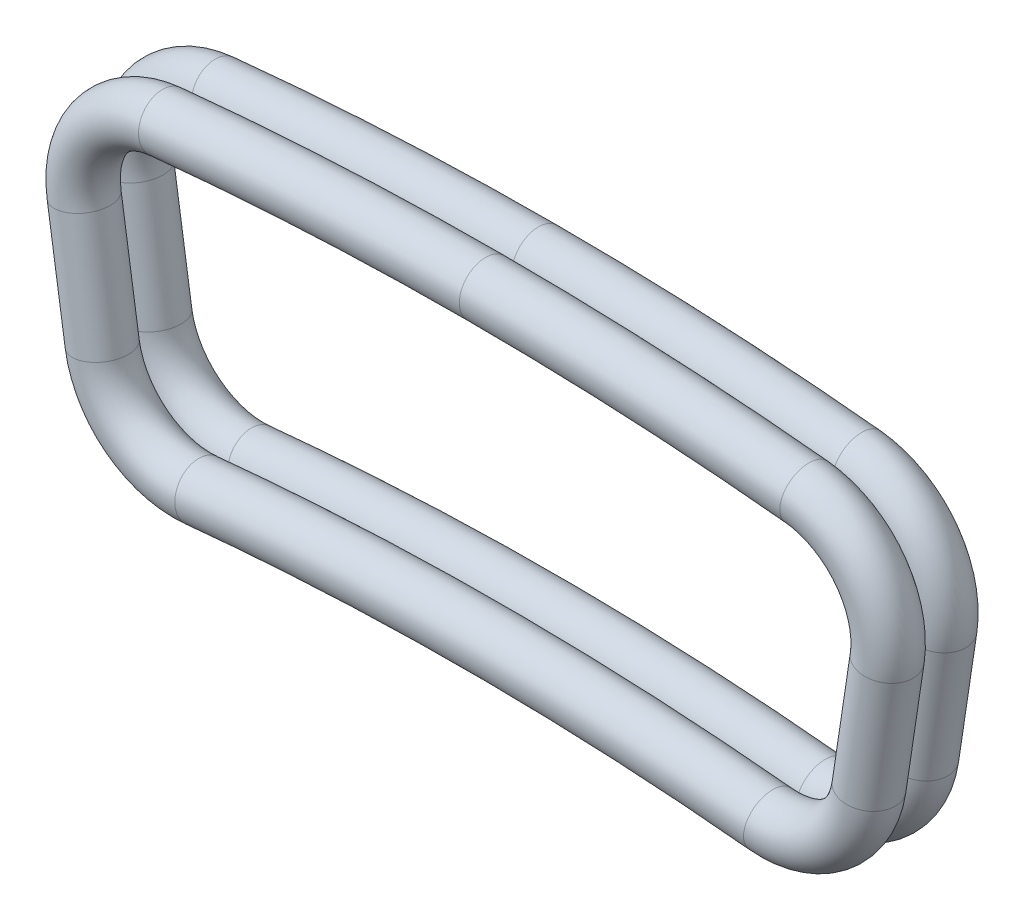
from build123d import *

# Parameters (mm, degrees)
SKETCH4_R       = 0.814
LPATTERN1_COUNT = 2
LPATTERN1_PITCH = 1.628


with BuildPart() as part:
    # Sweep2: sweep along a path in Sketch3
    with BuildLine(Plane.XY.offset(-3.186)) as sweep2_path:
        Line((11.845274932, 90.759308381), (12.403974274, 94.466036321))
        ThreePointArc((12.403974274, 94.466036321), (11.844320083, 96.610909759), (9.905288821, 97.685085092))
        ThreePointArc((9.905288821, 97.685085092), (0, 98.186), (-9.905288821, 97.685085092))
        ThreePointArc((-9.905288821, 97.685085092), (-11.844320083, 96.610909759), (-12.403974274, 94.466036321))
        Line((-12.403974274, 94.466036321), (-11.845274932, 90.759308381))
        ThreePointArc((-11.845274932, 90.759308381), (-10.79037915, 88.957511394), (-8.784379018, 88.378511423))
        ThreePointArc((-8.784379018, 88.378511423), (0, 88.814), (8.784379018, 88.378511423))
        ThreePointArc((8.784379018, 88.378511423), (10.79037915, 88.957511394), (11.845274932, 90.759308381))
    # Sketch4 → Sweep2 (sweep)
    with BuildSketch(Plane(origin=(0, 0, 0), x_dir=(0, 0, -1), z_dir=(1, 0, 0))):
        with Locations((3.186, 98.186)):
            Circle(SKETCH4_R)
    sweep(path=sweep2_path.line)


with BuildPart() as lpattern1_1:
    # LPattern1: pattern copy
    add(part.part.moved(Location(Vector(0, 0, 1) * (1 * LPATTERN1_PITCH))))


solid = Compound([part.part, lpattern1_1.part])
